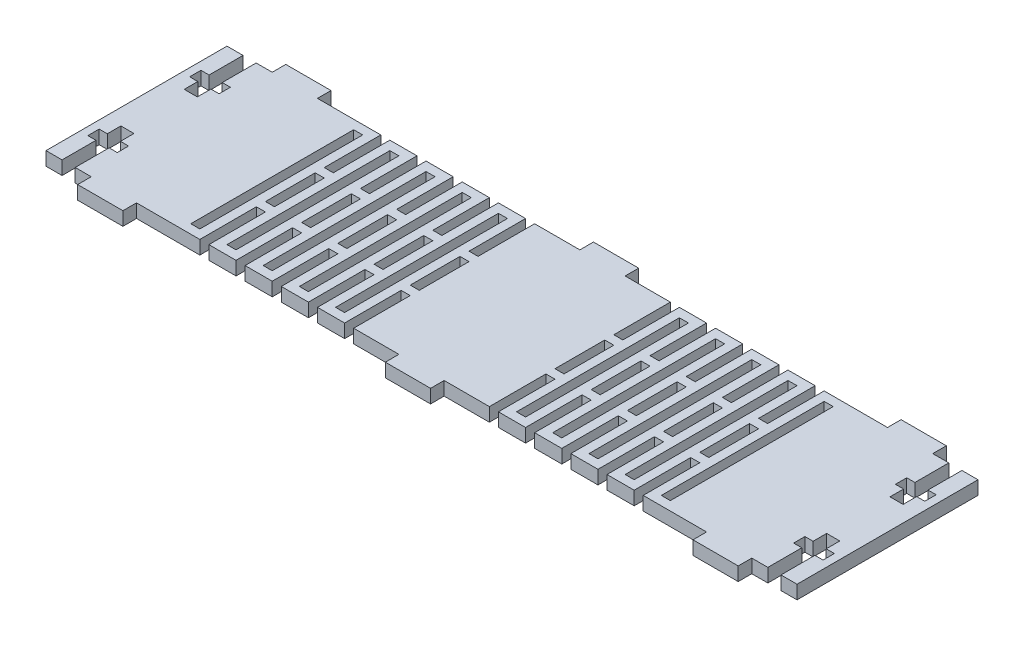
from build123d import *

# Parameters (mm, degrees)
SKETCH1_W           = 2
SKETCH1_H           = 36
SKETCH1_H_2         = 11
BOSS_EXTRUDE1_DEPTH = 3


with BuildPart() as part:
    # Sketch1 → Boss-Extrude1 (new body)
    with BuildSketch(Plane(origin=(0, 0, 0), x_dir=(1, 0, 0), z_dir=(0, 1, 0))):
        Polygon((-83, 40), (-79.45, 40), (-79.45, 32.5), (-81.25, 32.5), (-81.25, 30), (-79.45, 30), (-79.45, 27), (-76.55, 27), (-76.55, 30), (-74.75, 30), (-74.75, 32.5), (-76.55, 32.5), (-76.55, 40), (-73, 40), (-73, 43), (-63, 43), (-63, 40), (-49, 40), (-49, 27.5), (-47, 27.5), (-47, 40), (-41, 40), (-41, 27.5), (-39, 27.5), (-39, 40), (-33, 40), (-33, 27.5), (-31, 27.5), (-31, 40), (-25, 40), (-25, 27.5), (-23, 27.5), (-23, 40), (-17, 40), (-17, 27.5), (-15, 27.5), (-15, 40), (-5, 40), (-5, 43), (5, 43), (5, 40), (15, 40), (15, 27.5), (17, 27.5), (17, 40), (23, 40), (23, 27.5), (25, 27.5), (25, 40), (31, 40), (31, 27.5), (33, 27.5), (33, 40), (39, 40), (39, 27.5), (41, 27.5), (41, 40), (47, 40), (47, 27.5), (49, 27.5), (49, 40), (63, 40), (63, 43), (73, 43), (73, 40), (76.55, 40), (76.55, 32.5), (74.75, 32.5), (74.75, 30), (76.55, 30), (76.55, 27), (79.45, 27), (79.45, 30), (81.25, 30), (81.25, 32.5), (79.45, 32.5), (79.45, 40), (83, 40), (83, 0), (79.45, 0), (79.45, 7.5), (81.25, 7.5), (81.25, 10), (79.45, 10), (79.45, 13), (76.55, 13), (76.55, 10), (74.75, 10), (74.75, 7.5), (76.55, 7.5), (76.55, 0), (73, 0), (73, -3), (63, -3), (63, 0), (49, 0), (49, 12.5), (47, 12.5), (47, 0), (41, 0), (41, 12.5), (39, 12.5), (39, 0), (33, 0), (33, 12.5), (31, 12.5), (31, 0), (25, 0), (25, 12.5), (23, 12.5), (23, 0), (17, 0), (17, 12.5), (15, 12.5), (15, 0), (5, 0), (5, -3), (-5, -3), (-5, 0), (-15, 0), (-15, 12.5), (-17, 12.5), (-17, 0), (-23, 0), (-23, 12.5), (-25, 12.5), (-25, 0), (-31, 0), (-31, 12.5), (-33, 12.5), (-33, 0), (-39, 0), (-39, 12.5), (-41, 12.5), (-41, 0), (-47, 0), (-47, 12.5), (-49, 12.5), (-49, 0), (-63, 0), (-63, -3), (-73, -3), (-73, 0), (-76.55, 0), (-76.55, 7.5), (-74.75, 7.5), (-74.75, 10), (-76.55, 10), (-76.55, 13), (-79.45, 13), (-79.45, 10), (-81.25, 10), (-81.25, 7.5), (-79.45, 7.5), (-79.45, 0), (-83, 0), align=None)
        with Locations((-52, 20)):
            Rectangle(SKETCH1_W, SKETCH1_H, mode=Mode.SUBTRACT)
        with Locations((-44, 20)):
            Rectangle(SKETCH1_W, SKETCH1_H, mode=Mode.SUBTRACT)
        with Locations((-36, 20)):
            Rectangle(SKETCH1_W, SKETCH1_H, mode=Mode.SUBTRACT)
        with Locations((-28, 20)):
            Rectangle(SKETCH1_W, SKETCH1_H, mode=Mode.SUBTRACT)
        with Locations((-20, 20)):
            Rectangle(SKETCH1_W, SKETCH1_H, mode=Mode.SUBTRACT)
        with Locations((-48, 20)):
            Rectangle(SKETCH1_W, SKETCH1_H_2, mode=Mode.SUBTRACT)
        with Locations((-40, 20)):
            Rectangle(SKETCH1_W, SKETCH1_H_2, mode=Mode.SUBTRACT)
        with Locations((-32, 20)):
            Rectangle(SKETCH1_W, SKETCH1_H_2, mode=Mode.SUBTRACT)
        with Locations((-24, 20)):
            Rectangle(SKETCH1_W, SKETCH1_H_2, mode=Mode.SUBTRACT)
        with Locations((-16, 20)):
            Rectangle(SKETCH1_W, SKETCH1_H_2, mode=Mode.SUBTRACT)
        with Locations((16, 20)):
            Rectangle(SKETCH1_W, SKETCH1_H_2, mode=Mode.SUBTRACT)
        with Locations((20, 20)):
            Rectangle(SKETCH1_W, SKETCH1_H, mode=Mode.SUBTRACT)
        with Locations((24, 20)):
            Rectangle(SKETCH1_W, SKETCH1_H_2, mode=Mode.SUBTRACT)
        with Locations((28, 20)):
            Rectangle(SKETCH1_W, SKETCH1_H, mode=Mode.SUBTRACT)
        with Locations((32, 20)):
            Rectangle(SKETCH1_W, SKETCH1_H_2, mode=Mode.SUBTRACT)
        with Locations((36, 20)):
            Rectangle(SKETCH1_W, SKETCH1_H, mode=Mode.SUBTRACT)
        with Locations((40, 20)):
            Rectangle(SKETCH1_W, SKETCH1_H_2, mode=Mode.SUBTRACT)
        with Locations((48, 20)):
            Rectangle(SKETCH1_W, SKETCH1_H_2, mode=Mode.SUBTRACT)
        with Locations((44, 20)):
            Rectangle(SKETCH1_W, SKETCH1_H, mode=Mode.SUBTRACT)
        with Locations((52, 20)):
            Rectangle(SKETCH1_W, SKETCH1_H, mode=Mode.SUBTRACT)
    extrude(amount=BOSS_EXTRUDE1_DEPTH)


solid = part.part
